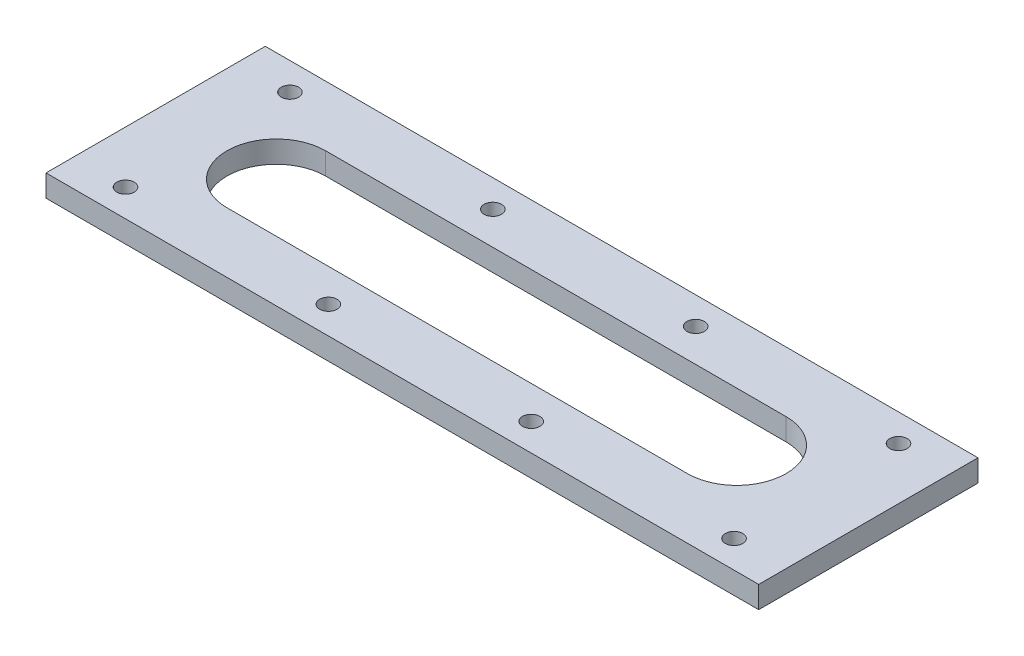
from build123d import *

# Parameters (mm, degrees)
ESBO_O1_W                 = 130
ESBO_O1_H                 = 40
RESSALTO_EXTRUS_O1_DEPTH  = 4
PADR_O_LINEAR1_COUNT      = 4
PADR_O_LINEAR1_PITCH      = 37
PADR_O_LINEAR1_COUNT_DIR2 = 2
PADR_O_LINEAR1_PITCH_DIR2 = 30


with BuildPart() as part:
    # Esboço1 → Ressalto-extrusão1 (new body)
    with BuildSketch(Plane(origin=(0, 0, 0), x_dir=(1, 0, 0), z_dir=(0, 1, 0))):
        with Locations((65, 20)):
            Rectangle(ESBO_O1_W, ESBO_O1_H)
        with BuildLine():
            Line((22, 29), (106, 29))
            ThreePointArc((106, 29), (115, 20), (106, 11))
            Line((106, 11), (22, 11))
            ThreePointArc((22, 11), (13, 20), (22, 29))
        make_face(mode=Mode.SUBTRACT)
    extrude(amount=RESSALTO_EXTRUS_O1_DEPTH)

    # Esboço4 → Escareado para parafuso com cabeça escareada elevada de M31 (revolve, cut)
    with BuildSketch(Plane(origin=(9.5, 0, -35), x_dir=(0, 0, -1), z_dir=(1, 0, 0))):
        Polygon((0, 0), (0, 13.953866233), (1.5875, 13), (1.5875, 1.5625), (3.15, 0), align=None)
    escareado_para_parafuso_com_cabe_a_escar = revolve(axis=Axis((9.5, -6.35, -35), (0, 1, 0)), mode=Mode.SUBTRACT)

    # Padrão linear1: Escareado para parafuso com cabe_a escar 4 × 2
    with Locations(*[(i * PADR_O_LINEAR1_PITCH, 0, j * PADR_O_LINEAR1_PITCH_DIR2) for i in range(PADR_O_LINEAR1_COUNT) for j in range(PADR_O_LINEAR1_COUNT_DIR2) if (i, j) != (0, 0)]):
        add(escareado_para_parafuso_com_cabe_a_escar, mode=Mode.SUBTRACT)


solid = part.part
